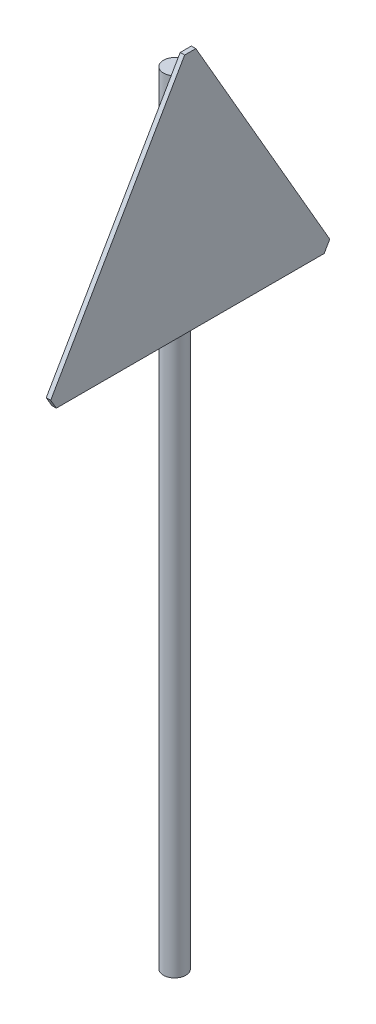
from build123d import *

# Parameters (mm, degrees)
SKETCH1_R            = 0.5
BOSS_EXTRUDE1_DEPTH  = 35
BOSS_EXTRUDE2_DEPTH  = 0.2
CHAMFER1_SIZE        = 0.5
CHAMFER1_EDGE_2_SIZE = 0.5
CHAMFER2_SIZE        = 0.5


with BuildPart() as part:
    # Sketch1 → Boss-Extrude1 (new body)
    with BuildSketch(Plane(origin=(0, 0, 0), x_dir=(1, 0, 0), z_dir=(0, 1, 0))):
        with Locations(Location((0, 0, 0), (0, 0, 270))):
            Circle(SKETCH1_R)
    extrude(amount=BOSS_EXTRUDE1_DEPTH)


with BuildPart() as body_2:
    # Sketch2 → Boss-Extrude2 (new body)
    with BuildSketch(Plane(origin=(0.5, 0, 0), x_dir=(0, 0, -1), z_dir=(1, 0, 0))):
        Polygon((6.5, 25.100052456), (0, 36.358382705), (-6.5, 25.100052456), align=None)
    extrude(amount=BOSS_EXTRUDE2_DEPTH)

    # Chamfer1
    chamfer1_edges = [body_2.edges().sort_by_distance(p)[0] for p in [
        (0.6, 25.100052456, -6.5),
    ]]
    chamfer(chamfer1_edges, length=CHAMFER1_SIZE)

    # Chamfer1 edge 2
    chamfer1_edge_2_edges = [body_2.edges().sort_by_distance(p)[0] for p in [
        (0.6, 25.100052456, 6.5),
    ]]
    chamfer(chamfer1_edge_2_edges, length=CHAMFER1_EDGE_2_SIZE)

    # Chamfer2
    chamfer2_edges = [body_2.edges().sort_by_distance(p)[0] for p in [
        (0.6, 36.358382705, 0),
    ]]
    chamfer(chamfer2_edges, length=CHAMFER2_SIZE)


solid = Compound([part.part, body_2.part])
